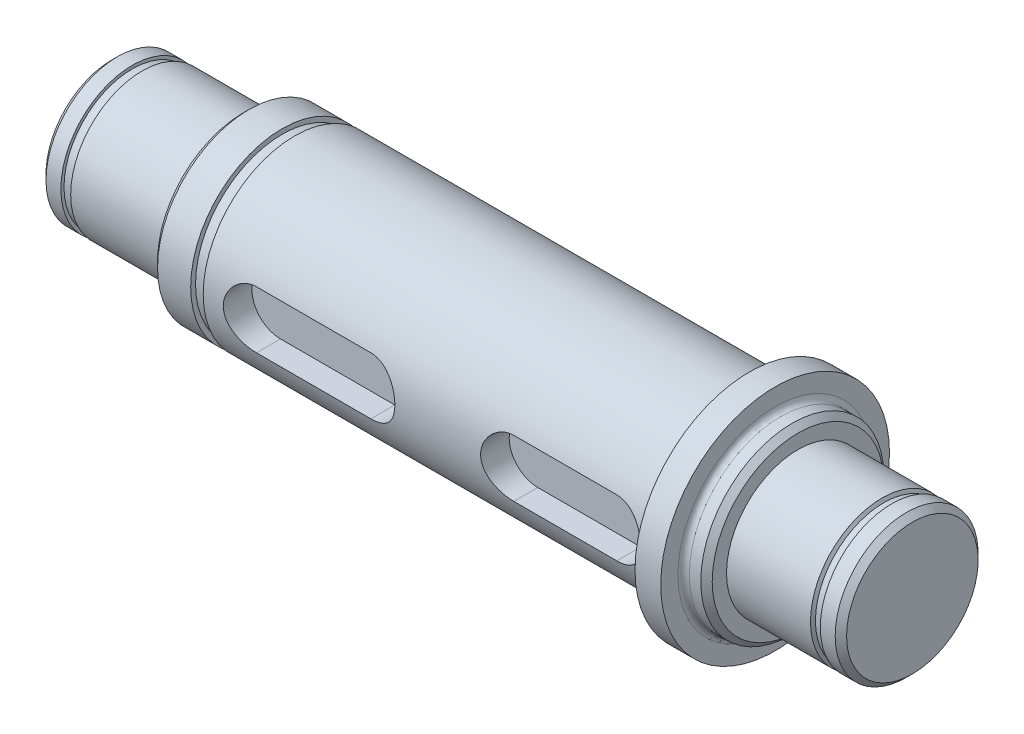
from build123d import *

# Parameters (mm, degrees)
TAGLIO_ESTRUSIONE1_DEPTH = 5
SMUSSO1_SIZE             = 1
SMUSSO2_SIZE             = 1
SMUSSO3_SIZE             = 1
RACCORDO3_R              = 1


with BuildPart() as part:
    # Schizzo1 → Rivoluzione1 (revolve)
    with BuildSketch(Plane.XY, mode=Mode.PRIVATE) as rivoluzione1_sk:
        Polygon((0, 0), (0, 12.5), (3.6, 12.5), (3.6, 11.95), (5, 11.95), (5.317542648, 12.5), (23, 12.5), (23, 16), (29.8, 16), (29.8, 15.15), (31.5, 15.15), (31.990747729, 16), (111.5, 16), (111.5, 20), (116, 20), (116, 16), (120, 16), (120, 12.5), (134.682457352, 12.5), (135, 11.95), (136.4, 11.95), (136.4, 12.5), (140, 12.5), (140, 0), align=None)
    revolve(rivoluzione1_sk.sketch.rotate(Axis((0, 0, 0), (1, 0, 0)), 90), axis=Axis((0, 0, 0), (1, 0, 0)))

    # Schizzo2 → Taglio-Estrusione1 (cut)
    with BuildSketch(Plane.XY.offset(16)):
        with BuildLine():
            Line((40.5, 5), (60.5, 5))
            ThreePointArc((60.5, 5), (65.5, 0), (60.5, -5))
            Line((60.5, -5), (40.5, -5))
            ThreePointArc((40.5, -5), (35.5, 0), (40.5, 5))
        make_face()
        with BuildLine():
            Line((85.5, 5), (103.5, 5))
            ThreePointArc((103.5, 5), (108.5, 0), (103.5, -5))
            Line((103.5, -5), (85.5, -5))
            ThreePointArc((85.5, -5), (80.5, 0), (85.5, 5))
        make_face()
    extrude(amount=-TAGLIO_ESTRUSIONE1_DEPTH, mode=Mode.SUBTRACT)

    # Smusso1
    smusso1_edges = [part.edges().sort_by_distance(p)[0] for p in [
        (0, 0, -12.5),
    ]]
    chamfer(smusso1_edges, length=SMUSSO1_SIZE)

    # Smusso2
    smusso2_edges = [part.edges().sort_by_distance(p)[0] for p in [
        (140, 0, -12.5),
    ]]
    chamfer(smusso2_edges, length=SMUSSO2_SIZE)

    # Smusso3
    smusso3_edges = [part.edges().sort_by_distance(p)[0] for p in [
        (120, 0, -16),
        (23, 0, -16),
    ]]
    chamfer(smusso3_edges, length=SMUSSO3_SIZE)

    # Raccordo3
    raccordo3_edges = [part.edges().sort_by_distance(p)[0] for p in [
        (116, 0, -16),
        (111.5, 0, -16),
    ]]
    fillet(raccordo3_edges, radius=RACCORDO3_R)


solid = part.part
